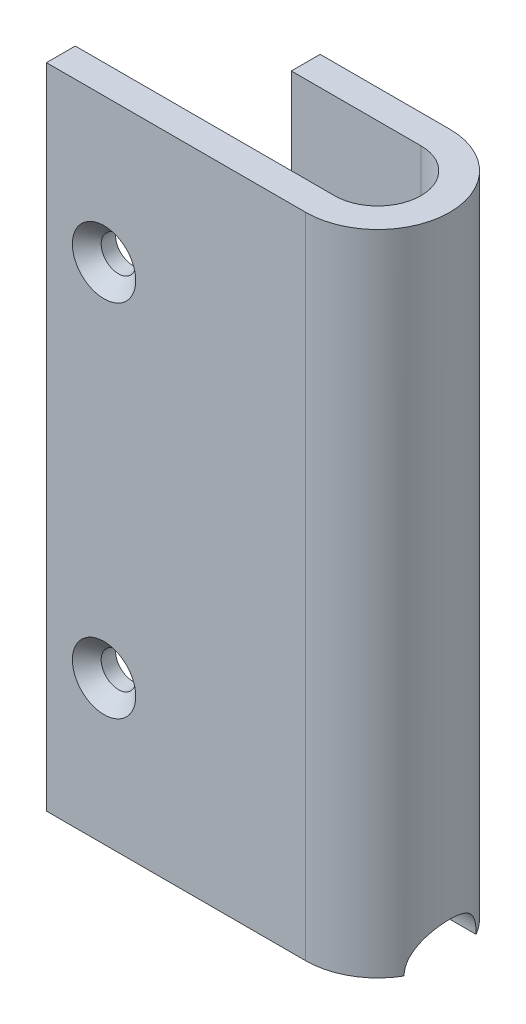
from build123d import *

# Parameters (mm, degrees)
BOSS_EXTRUDE1_DEPTH                                 = 45
SKETCH2_R                                           = 1
CUT_EXTRUDE1_DEPTH                                  = 5
SKETCH3_R                                           = 2.5
CUT_EXTRUDE2_DEPTH                                  = 6
CSK_FOR_M2_COUNTERSUNK_FLAT_HEAD_SCREW1_D           = 2.4
CSK_FOR_M2_COUNTERSUNK_FLAT_HEAD_SCREW1_CSINK_D     = 4.4
CSK_FOR_M2_COUNTERSUNK_FLAT_HEAD_SCREW1_CSINK_ANGLE = 90


with BuildPart() as part:
    # Sketch1 → Boss-Extrude1 (new body)
    with BuildSketch(Plane(origin=(0, 0, 0), x_dir=(1, 0, 0), z_dir=(0, 1, 0))):
        with BuildLine():
            Line((0, 3), (-9, 3))
            Line((-9, 3), (-9, 5))
            Line((-9, 5), (0, 5))
            ThreePointArc((0, 5), (5, 0), (0, -5))
            Line((0, -5), (-18, -5))
            Line((-18, -5), (-18, -3))
            Line((-18, -3), (0, -3))
            ThreePointArc((0, -3), (3, 0), (0, 3))
        make_face()
    extrude(amount=BOSS_EXTRUDE1_DEPTH)

    # Sketch2 → Cut-Extrude1 (cut)
    with BuildSketch(Plane(origin=(0, 0, -5), x_dir=(-1, 0, 0), z_dir=(0, 0, -1))):
        with Locations((9, 17.5)):
            Circle(SKETCH2_R)
    extrude(amount=-CUT_EXTRUDE1_DEPTH, mode=Mode.SUBTRACT)

    # Sketch3 → Cut-Extrude2 (cut)
    with BuildSketch(Plane(origin=(0, 0, 0), x_dir=(0, 0, -1), z_dir=(1, 0, 0))):
        Circle(SKETCH3_R)
    extrude(amount=CUT_EXTRUDE2_DEPTH, mode=Mode.SUBTRACT)

    # CSK for M2 Countersunk Flat Head Screw1 (through all)
    with Locations(Plane(origin=(-14, 35, 5), x_dir=(1, 0, 0), z_dir=(0, 0, 1))):
        with Locations((0, 0), (0, -25)):
            CounterSinkHole(CSK_FOR_M2_COUNTERSUNK_FLAT_HEAD_SCREW1_D / 2, CSK_FOR_M2_COUNTERSUNK_FLAT_HEAD_SCREW1_CSINK_D / 2, counter_sink_angle=CSK_FOR_M2_COUNTERSUNK_FLAT_HEAD_SCREW1_CSINK_ANGLE)


solid = part.part
